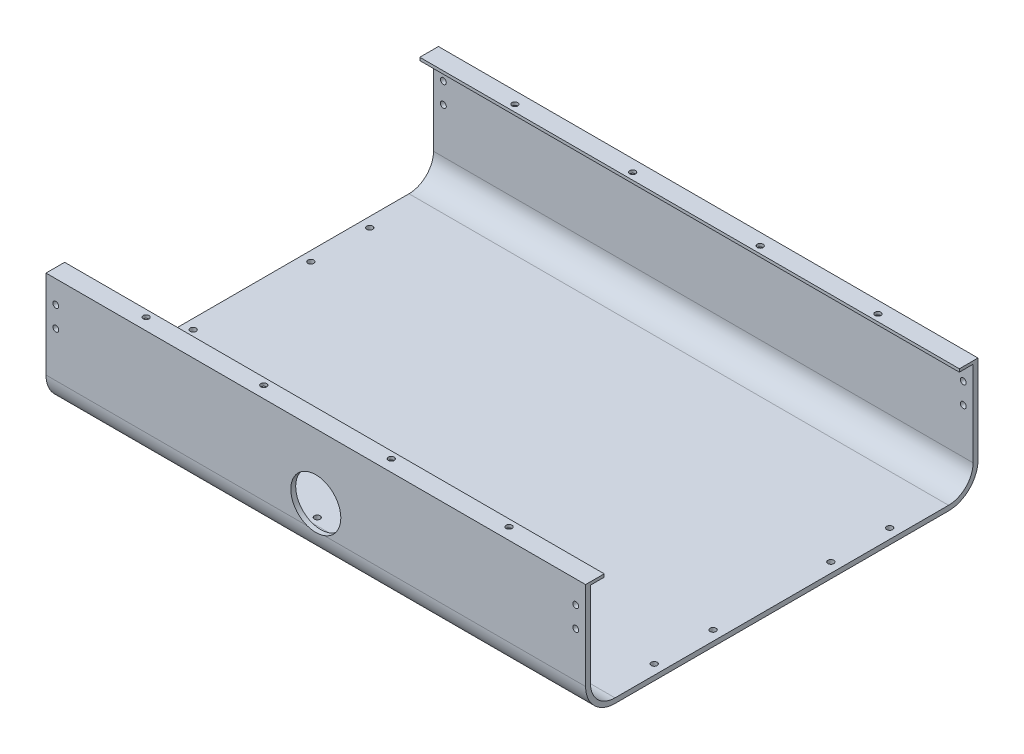
from build123d import *

# Parameters (mm, degrees)
EXTRUDE_1_DEPTH     = 275
SKETCH_6_R          = 25.5
CUT_EXTRUDE_3_DEPTH = 50
SKETCH_11_R         = 2
SKETCH_11_R_2       = 3
CUT_EXTRUDE_4_DEPTH = 10
SKETCH_12_R         = 3
CUT_EXTRUDE_5_DEPTH = 501.02499951
SKETCH_13_R         = 3
CUT_EXTRUDE_6_DEPTH = 13
SKETCH_14_R         = 3
CUT_EXTRUDE_7_DEPTH = 13


with BuildPart() as part:
    # 草图1 → 凸台-拉伸1 (new, symmetric)
    with BuildSketch(Plane(origin=(0, 0, 0), x_dir=(0, 0, -1), z_dir=(1, 0, 0))):
        with BuildLine():
            Line((0, 0), (-170, 0))
            ThreePointArc((-170, 0), (-191.213203436, 8.786796564), (-200, 30))
            Line((-200, 30), (-200, 120))
            Line((-200, 120), (-181, 120))
            Line((-181, 120), (-181, 117))
            Line((-181, 117), (-195, 117))
            Line((-195, 117), (-195, 115))
            Line((-195, 115), (-195, 30))
            ThreePointArc((-195, 30), (-187.67766953, 12.32233047), (-170, 5))
            Line((-170, 5), (0, 5))
            Line((0, 5), (170, 5))
            ThreePointArc((170, 5), (187.67766953, 12.32233047), (195, 30))
            Line((195, 30), (195, 115))
            Line((195, 115), (195, 117))
            Line((195, 117), (181, 117))
            Line((181, 117), (181, 120))
            Line((181, 120), (200, 120))
            Line((200, 120), (200, 30))
            ThreePointArc((200, 30), (191.213203436, 8.786796564), (170, 0))
            Line((170, 0), (0, 0))
        make_face()
    extrude(amount=EXTRUDE_1_DEPTH, both=True)

    # 草图6 → 切除-拉伸3 (cut)
    with BuildSketch(Plane.XY.offset(200)):
        with Locations(Location((0, 54, 0), (0, 0, 289.749922796))):
            Circle(SKETCH_6_R)
    extrude(amount=-CUT_EXTRUDE_3_DEPTH, mode=Mode.SUBTRACT)

    # 草图11 → 切除-拉伸4 (cut)
    with BuildSketch(Plane.XZ):
        with Locations(Location((-23, 125, 0), (0, 0, 270))):
            Circle(SKETCH_11_R)
        with Locations(Location((-36, 162.5, 0), (0, 0, 270))):
            Circle(SKETCH_11_R_2)
        with Locations(Location((-36, 87.5, 0), (0, 0, 270))):
            Circle(SKETCH_11_R_2)
        with Locations(Location((36, 87.5, 0), (0, 0, 90))):
            Circle(SKETCH_11_R_2)
        with Locations(Location((36, 162.5, 0), (0, 0, 90))):
            Circle(SKETCH_11_R_2)
        with Locations(Location((23, 125, 0), (0, 0, 90))):
            Circle(SKETCH_11_R)
    extrude(amount=-CUT_EXTRUDE_4_DEPTH, mode=Mode.SUBTRACT)

    # 草图12 → 切除-拉伸5 (cut, through all)
    with BuildSketch(Plane(origin=(0, 0, -200), x_dir=(-1, 0, 0), z_dir=(0, 0, -1))):
        with Locations(Location((-265, 97, 0), (0, 0, 90))):
            Circle(SKETCH_12_R)
        with Locations(Location((-265, 76, 0), (0, 0, 90))):
            Circle(SKETCH_12_R)
    cut_extrude_5 = extrude(amount=-CUT_EXTRUDE_5_DEPTH, mode=Mode.SUBTRACT)

    # 镜向1: 切除-拉伸5 across plane
    add(cut_extrude_5.mirror(Plane(origin=(0, 0, 0), x_dir=(0, 0, 1), z_dir=(1, 0, 0))), mode=Mode.SUBTRACT)

    # 草图13 → 切除-拉伸6 (cut)
    with BuildSketch(Plane.XZ):
        with Locations(Location((-265, 120, 0), (0, 0, 270))):
            Circle(SKETCH_13_R)
        with Locations(Location((-265, 60, 0), (0, 0, 270))):
            Circle(SKETCH_13_R)
        with Locations(Location((-265, -120, 0), (0, 0, 270))):
            Circle(SKETCH_13_R)
        with Locations(Location((-265, -60, 0), (0, 0, 270))):
            Circle(SKETCH_13_R)
    cut_extrude_6 = extrude(amount=-CUT_EXTRUDE_6_DEPTH, mode=Mode.SUBTRACT)

    # 镜向2: 切除-拉伸6 across plane
    add(cut_extrude_6.mirror(Plane(origin=(0, 0, 0), x_dir=(0, 0, 1), z_dir=(1, 0, 0))), mode=Mode.SUBTRACT)

    # 草图14 → 切除-拉伸7 (cut)
    with BuildSketch(Plane(origin=(0, 120, 0), x_dir=(1, 0, 0), z_dir=(0, 1, 0))):
        with Locations(Location((-185, -188, 0), (0, 0, 270))):
            Circle(SKETCH_14_R)
        with Locations(Location((-65, -188, 0), (0, 0, 270))):
            Circle(SKETCH_14_R)
        with Locations(Location((65, -188, 0), (0, 0, 270))):
            Circle(SKETCH_14_R)
        with Locations(Location((185, -188, 0), (0, 0, 270))):
            Circle(SKETCH_14_R)
        with Locations(Location((185, 188, 0), (0, 0, 270))):
            Circle(SKETCH_14_R)
        with Locations(Location((65, 188, 0), (0, 0, 270))):
            Circle(SKETCH_14_R)
        with Locations(Location((-65, 188, 0), (0, 0, 270))):
            Circle(SKETCH_14_R)
        with Locations(Location((-185, 188, 0), (0, 0, 270))):
            Circle(SKETCH_14_R)
    extrude(amount=-CUT_EXTRUDE_7_DEPTH, mode=Mode.SUBTRACT)


solid = part.part
